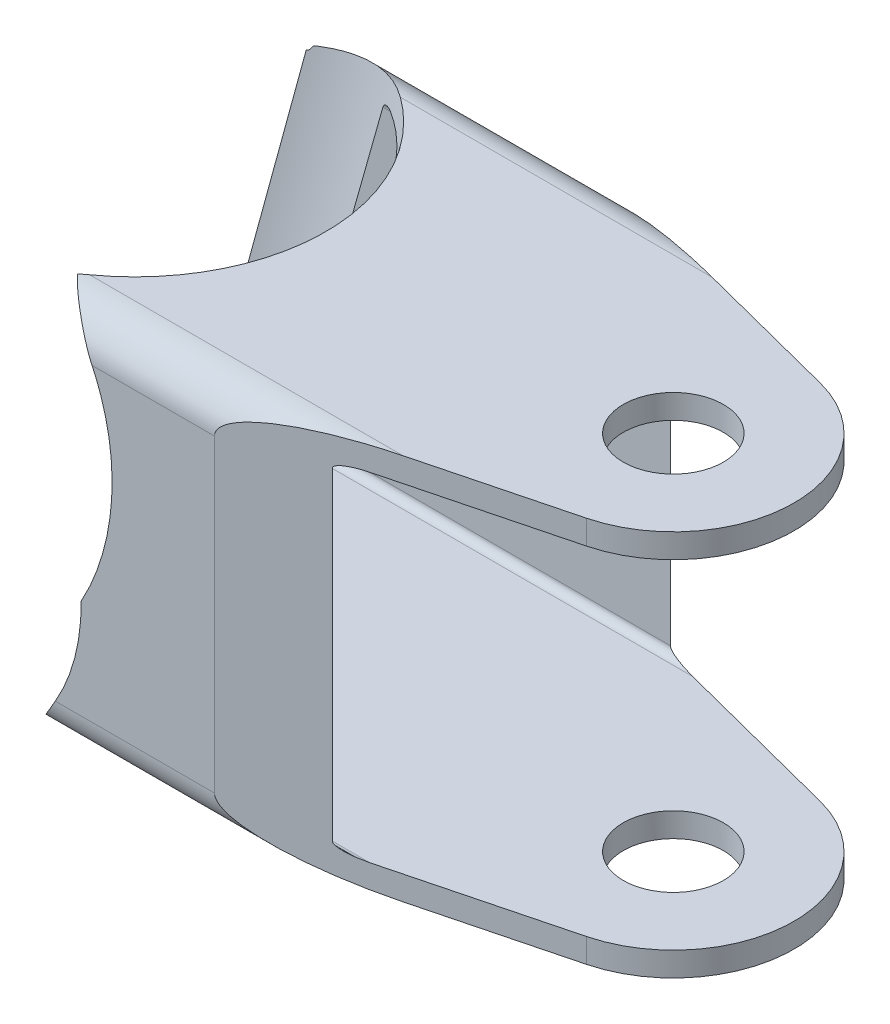
from build123d import *

# Parameters (mm, degrees)
BOSS_EXTRUDE1_DEPTH      = 25.4
BOSS_EXTRUDE1_DEPTH_BACK = 34.925
CUT_EXTRUDE4_DEPTH       = 63.941922635
CUT_EXTRUDE5_DEPTH       = 46.01339384
SKETCH14_R               = 3.2893
CUT_EXTRUDE6_DEPTH       = 46.01339384
CUT_EXTRUDE7_DEPTH       = 11.43
CUT_EXTRUDE7_DEPTH_BACK  = 12.7
SKETCH16_R               = 12.7
CUT_EXTRUDE9_DEPTH       = 4.445
CUT_EXTRUDE9_DEPTH_BACK  = 12.7
SKETCH17_R               = 12.7
CUT_EXTRUDE10_DEPTH      = 11.684
CUT_EXTRUDE10_DEPTH_BACK = 12.7
SKETCH18_R               = 12.7
CUT_EXTRUDE11_DEPTH      = 8.128
CUT_EXTRUDE11_DEPTH_BACK = 12.7
SKETCH19_R               = 12.7
CUT_EXTRUDE12_DEPTH      = 35.814
CUT_EXTRUDE12_DEPTH_BACK = 12.7
SKETCH20_R               = 12.7
SKETCH23_W               = 43.939314544
SKETCH23_H               = 38.266398347
CUT_EXTRUDE13_DEPTH      = 51.98499249


with BuildPart() as part:
    # Sketch1 → Boss-Extrude1 (new, two sides: drawn at the far end of the back side and taken through both)
    with BuildSketch(Plane(origin=(0, 0, 0), x_dir=(0, 0, -1), z_dir=(1, 0, 0)).offset(-BOSS_EXTRUDE1_DEPTH_BACK)):
        with BuildLine():
            Line((-10.16, 12.7), (10.16, 12.7))
            ThreePointArc((10.16, 12.7), (11.956051224, 11.956051224), (12.7, 10.16))
            Line((12.7, 10.16), (12.7, -10.16))
            ThreePointArc((12.7, -10.16), (11.956051224, -11.956051224), (10.16, -12.7))
            Line((10.16, -12.7), (-10.16, -12.7))
            ThreePointArc((-10.16, -12.7), (-11.956051224, -11.956051224), (-12.7, -10.16))
            Line((-12.7, -10.16), (-12.7, 10.16))
            ThreePointArc((-12.7, 10.16), (-11.956051224, 11.956051224), (-10.16, 12.7))
        make_face()
    extrude(amount=BOSS_EXTRUDE1_DEPTH + BOSS_EXTRUDE1_DEPTH_BACK)

    # Sketch11 → Cut-Extrude4 (cut, through all)
    with BuildSketch(Plane(origin=(25.4, 0, 0), x_dir=(0, 0, -1), z_dir=(1, 0, 0))):
        with BuildLine():
            Line((-10.6045, 11.1125), (10.6045, 11.1125))
            ThreePointArc((10.6045, 11.1125), (10.963710245, 10.963710245), (11.1125, 10.6045))
            Line((11.1125, 10.6045), (11.1125, -10.6045))
            ThreePointArc((11.1125, -10.6045), (10.963710245, -10.963710245), (10.6045, -11.1125))
            Line((10.6045, -11.1125), (-10.6045, -11.1125))
            ThreePointArc((-10.6045, -11.1125), (-10.963710245, -10.963710245), (-11.1125, -10.6045))
            Line((-11.1125, -10.6045), (-11.1125, 10.6045))
            ThreePointArc((-11.1125, 10.6045), (-10.963710245, 10.963710245), (-10.6045, 11.1125))
        make_face()
    extrude(amount=-CUT_EXTRUDE4_DEPTH, mode=Mode.SUBTRACT)

    # Sketch12 → Cut-Extrude5 (cut, through all)
    with BuildSketch(Plane(origin=(0, 12.7, 0), x_dir=(1, 0, 0), z_dir=(0, 1, 0))):
        with BuildLine():
            Line((50.8, 12.7), (0, 12.7))
            Line((0, 12.7), (19.444424463, 7.686083637))
            ThreePointArc((19.444424463, 7.686083637), (25.4, 0), (19.444424463, -7.686083637))
            Line((19.444424463, -7.686083637), (0, -12.7))
            Line((0, -12.7), (50.8, -12.7))
            Line((50.8, -12.7), (50.8, 12.7))
        make_face()
    extrude(amount=-CUT_EXTRUDE5_DEPTH, mode=Mode.SUBTRACT)

    # Sketch14 → Cut-Extrude6 (cut, through all)
    with BuildSketch(Plane(origin=(0, 12.7, 0), x_dir=(1, 0, 0), z_dir=(0, 1, 0))):
        with Locations((17.4625, 0)):
            Circle(SKETCH14_R)
    extrude(amount=-CUT_EXTRUDE6_DEPTH, mode=Mode.SUBTRACT)

    # Sketch16 → Cut-Extrude7 (cut, two sides: drawn at the far end of the back side and taken through both)
    with BuildSketch(Plane(origin=(-34.925, -0.334385976, 0.104098467), x_dir=(0, 0, -1), z_dir=(0.9661266940476224, -0.2580682294444864, 0)).offset(-CUT_EXTRUDE7_DEPTH_BACK)):
        Circle(SKETCH16_R)
    extrude(amount=CUT_EXTRUDE7_DEPTH + CUT_EXTRUDE7_DEPTH_BACK, mode=Mode.SUBTRACT)

    # Sketch17 → Cut-Extrude9 (cut, two sides: drawn at the far end of the back side and taken through both)
    with BuildSketch(Plane(origin=(-32.916827243, -0.772757615, 12.7), x_dir=(-0.7903344181486557, -0.13152541034589577, -0.5983916559603499), z_dir=(0.6126756952006714, -0.16966408080451095, -0.7719084092009456)).offset(-CUT_EXTRUDE9_DEPTH_BACK)):
        Circle(SKETCH17_R)
    extrude(amount=CUT_EXTRUDE9_DEPTH + CUT_EXTRUDE9_DEPTH_BACK, mode=Mode.SUBTRACT)

    # Sketch18 → Cut-Extrude10 (cut, two sides: drawn at the far end of the back side and taken through both)
    with BuildSketch(Plane(origin=(-21.542643879, -3.81098788, 12.7), x_dir=(-0.9940833845942288, -0.0023249747136505853, 0.10859474649477033), z_dir=(-0.1086196320822463, 0.0212780939148434, -0.9938556324968273)).offset(-CUT_EXTRUDE10_DEPTH_BACK)):
        Circle(SKETCH18_R)
    extrude(amount=CUT_EXTRUDE10_DEPTH + CUT_EXTRUDE10_DEPTH_BACK, mode=Mode.SUBTRACT)


with BuildPart() as cut_extrude10_kept_piece:
    # of the separate pieces the step leaves, the one the design keeps (cut_extrude10_pieces_kept)
    add(part.part.solids().sort_by_distance((-30.049470014, 11.591428998, 12.258239982))[0])

    # Sketch19 → Cut-Extrude11 (cut, two sides: drawn at the far end of the back side and taken through both)
    with BuildSketch(Plane(origin=(-19.809355594, 2.656223175, 12.7), x_dir=(-0.976329014515415, 0.09548845507502952, 0.194071147682346), z_dir=(-0.21629067343590866, -0.43103175814295336, -0.8760308031438369)).offset(-CUT_EXTRUDE11_DEPTH_BACK)):
        Circle(SKETCH19_R)
    extrude(amount=CUT_EXTRUDE11_DEPTH + CUT_EXTRUDE11_DEPTH_BACK, mode=Mode.SUBTRACT)

    # Sketch20 → Cut-Extrude12 (cut, two sides: drawn at the far end of the back side and taken through both)
    with BuildSketch(Plane(origin=(-18.580944095, 12.7, -0.022320862), x_dir=(-0.966128643141705, 0.25805311522873825, -0.0020086368292128215), z_dir=(-0.2580609325356477, -0.9660993767043436, 0.007519935525706789)).offset(-CUT_EXTRUDE12_DEPTH_BACK)):
        Circle(SKETCH20_R)
    extrude(amount=CUT_EXTRUDE12_DEPTH + CUT_EXTRUDE12_DEPTH_BACK, mode=Mode.SUBTRACT)

    # Sketch23 → Cut-Extrude13 (cut, through all)
    with BuildSketch(Plane(origin=(-20.509915766, 5.478533696, 0), x_dir=(-0.25806093253564755, -0.9660993767043435, 0.007519935525706789), z_dir=(-0.9661266940476223, 0.25806822944448626, 0))):
        with Locations((3.757671802, 1.25502674)):
            Rectangle(SKETCH23_W, SKETCH23_H)
    extrude(amount=CUT_EXTRUDE13_DEPTH, mode=Mode.SUBTRACT)


solid = cut_extrude10_kept_piece.part
